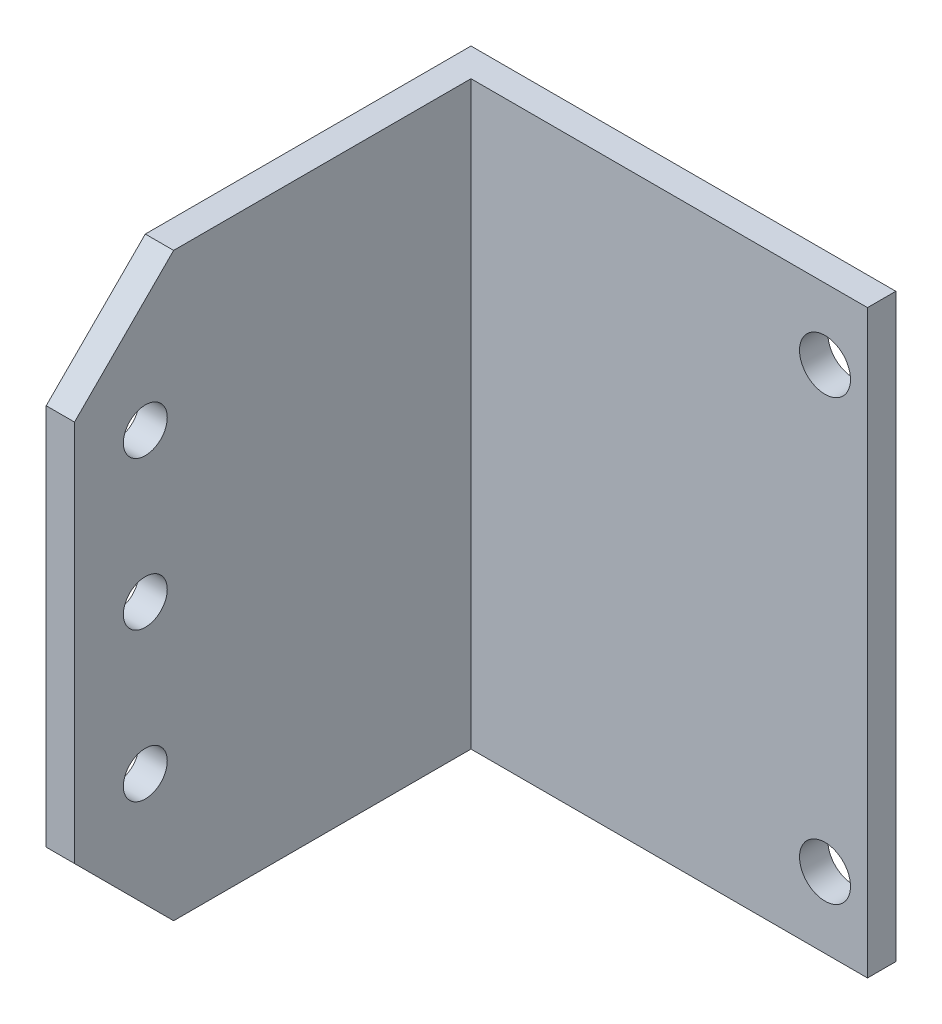
from build123d import *

# Parameters (mm, degrees)
SKETCH1_W           = 30
SKETCH1_H           = 41
SKETCH1_R           = 1.8
BOSS_EXTRUDE1_DEPTH = 2
SKETCH2_W           = 2
SKETCH2_H           = 41
BOSS_EXTRUDE2_DEPTH = 28
SKETCH3_R           = 1.55
CUT_EXTRUDE1_DEPTH  = 10


with BuildPart() as part:
    # Sketch1 → Boss-Extrude1 (new body)
    with BuildSketch(Plane.XY):
        with Locations((-15, 0)):
            Rectangle(SKETCH1_W, SKETCH1_H)
        with Locations((-3, 15.5)):
            Circle(SKETCH1_R, mode=Mode.SUBTRACT)
        with Locations((-3, -15.5)):
            Circle(SKETCH1_R, mode=Mode.SUBTRACT)
    extrude(amount=BOSS_EXTRUDE1_DEPTH)

    # Sketch2 → Boss-Extrude2 (add)
    with BuildSketch(Plane.XY.offset(2)):
        with Locations((-29, 0)):
            Rectangle(SKETCH2_W, SKETCH2_H)
    extrude(amount=BOSS_EXTRUDE2_DEPTH)

    # Sketch3 → Cut-Extrude1 (cut)
    with BuildSketch(Plane(origin=(-28, 0, 0), x_dir=(0, 0, -1), z_dir=(1, 0, 0))):
        with Locations((-25, 10.5)):
            Circle(SKETCH3_R)
        with Locations((-25, -10.5)):
            Circle(SKETCH3_R)
        with Locations((-25, 0)):
            Circle(SKETCH3_R)
        Polygon((-30, -13.5), (-23, -20.5), (-30, -20.5), align=None)
        Polygon((-30, 13.5), (-30, 20.5), (-23, 20.5), align=None)
    extrude(amount=-CUT_EXTRUDE1_DEPTH, mode=Mode.SUBTRACT)


solid = part.part
